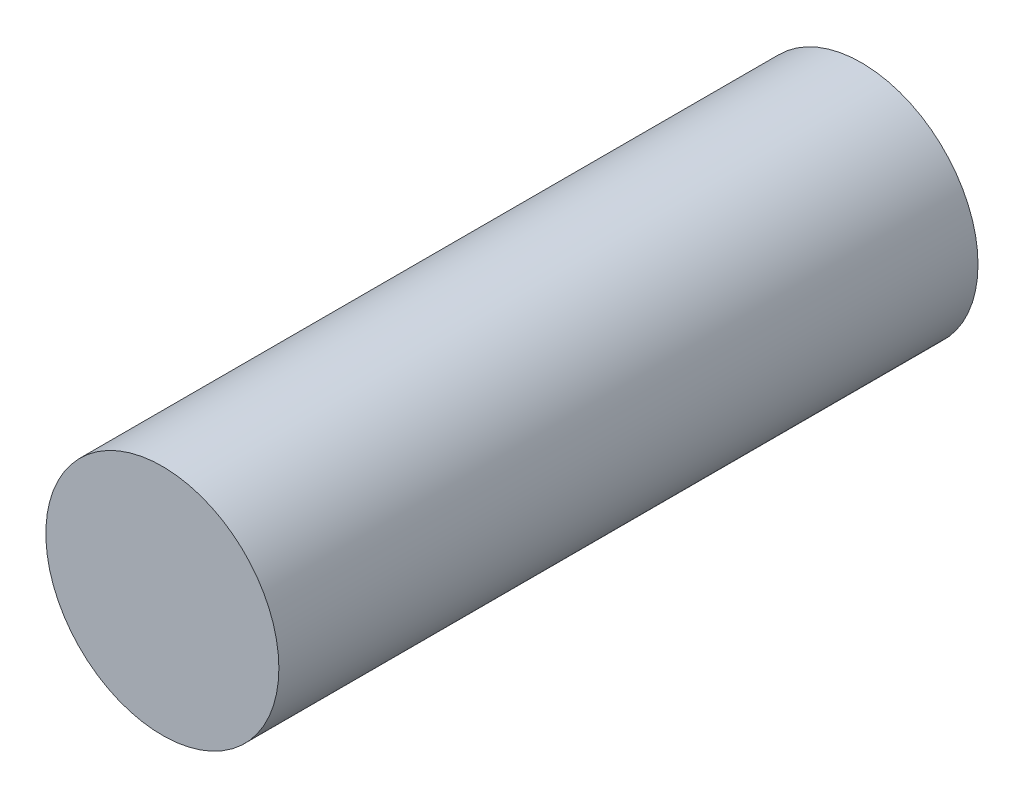
from build123d import *

# Parameters (mm, degrees)
ESQUISSE1_R      = 3
EXTRUSION1_DEPTH = 18


with BuildPart() as part:
    # Esquisse1 → Extrusion1 (new body)
    with BuildSketch(Plane.XY):
        Circle(ESQUISSE1_R)
    extrude(amount=EXTRUSION1_DEPTH)


solid = part.part
